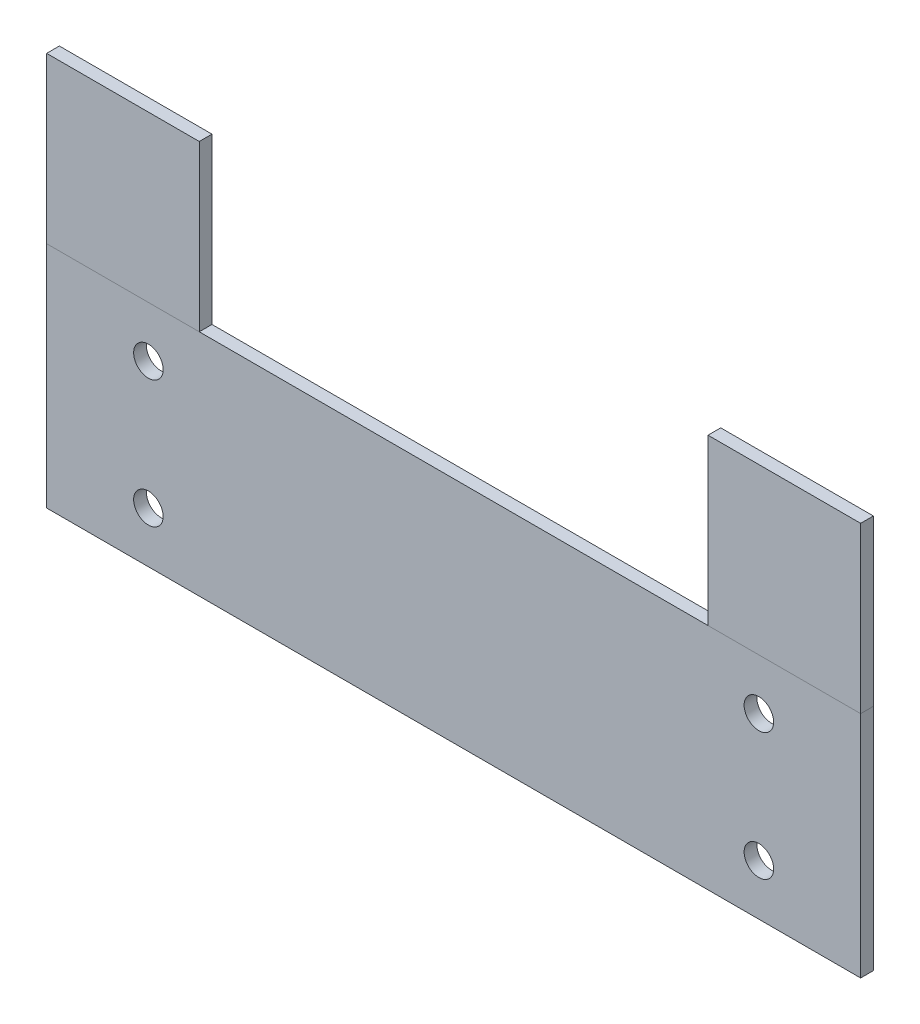
from build123d import *

# Parameters (mm, degrees)
SKETCH1_W             = 101.6
SKETCH1_H             = 28.575
BOSS_EXTRUDE1_DEPTH   = 1.5875
SKETCH2_R             = 1.8415
CUT_EXTRUDE1_DEPTH    = 53.794818046
SKETCH3_W             = 19.05
SKETCH3_H             = 20.574
BOSS_EXTRUDE2_DEPTH   = 1.5875
BOSS_EXTRUDE2_2_DEPTH = 1.5875


with BuildPart() as part:
    # Sketch1 → Boss-Extrude1 (new body)
    with BuildSketch(Plane.XY):
        Rectangle(SKETCH1_W, SKETCH1_H)
    extrude(amount=BOSS_EXTRUDE1_DEPTH)

    # Sketch2 → Cut-Extrude1 (cut, through all)
    with BuildSketch(Plane.XY.offset(1.5875)):
        with Locations((-38.1, 7.9375)):
            Circle(SKETCH2_R)
        with Locations((-38.1, -7.9375)):
            Circle(SKETCH2_R)
    cut_extrude1 = extrude(amount=-CUT_EXTRUDE1_DEPTH, mode=Mode.SUBTRACT)

    # Mirror1: Cut-Extrude1 across plane
    add(cut_extrude1.mirror(Plane(origin=(0, 0, 0), x_dir=(0, 0, 1), z_dir=(1, 0, 0))), mode=Mode.SUBTRACT)


with BuildPart() as body_2:
    # Sketch3 → Boss-Extrude2 (new body)
    with BuildSketch(Plane.XY.offset(1.5875)):
        with Locations((-41.275, 24.5745)):
            Rectangle(SKETCH3_W, SKETCH3_H)
    extrude(amount=-BOSS_EXTRUDE2_DEPTH)


with BuildPart() as body_3:
    # Sketch3 → Boss-Extrude2 2 (new body)
    with BuildSketch(Plane.XY.offset(1.5875)):
        with Locations((41.275, 24.5745)):
            Rectangle(SKETCH3_W, SKETCH3_H)
    extrude(amount=-BOSS_EXTRUDE2_2_DEPTH)


solid = Compound([part.part, body_2.part, body_3.part])
